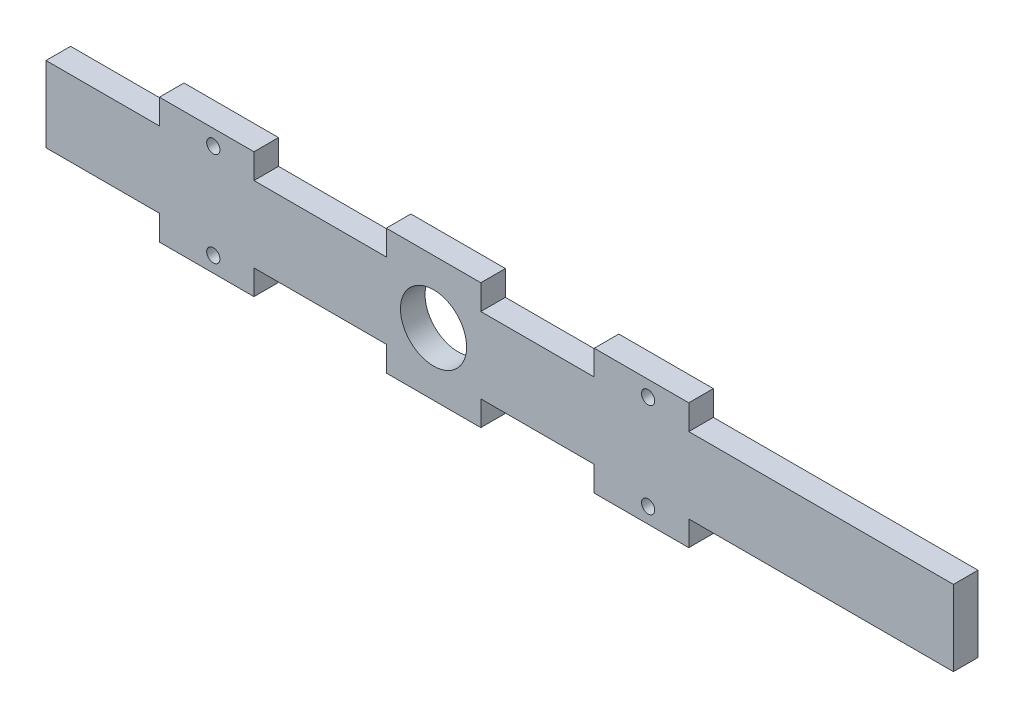
from build123d import *

# Parameters (mm, degrees)
SKETCH1_R              = 3.5
BOSS_EXTRUDE1_DEPTH    = 13
F_25_0MM_DOWEL_HOLE1_D = 35


with BuildPart() as part:
    # Sketch1 → Boss-Extrude1 (new body)
    with BuildSketch(Plane.XY):
        Polygon((-103.143983002, 33.195876289), (-53.143983002, 33.195876289), (-53.143983002, 20), (16.856016998, 20), (16.856016998, 33.195876289), (66.856016998, 33.195876289), (66.856016998, 20), (126.856016998, 20), (126.856016998, 33.195876289), (176.856016998, 33.195876289), (176.856016998, 20), (316.856016998, 20), (316.856016998, -20), (176.856016998, -20), (176.856016998, -33.195876289), (126.856016998, -33.195876289), (126.856016998, -20), (66.856016998, -20), (66.856016998, -33.195876289), (16.856016998, -33.195876289), (16.856016998, -20), (-53.143983002, -20), (-53.143983002, -33.195876289), (-103.143983002, -33.195876289), (-103.143983002, -20), (-163.143983002, -20), (-163.143983002, 20), (-103.143983002, 20), align=None)
        with Locations(Location((-74.643983002, 25, 0), (0, 0, 180))):
            Circle(SKETCH1_R, mode=Mode.SUBTRACT)
        with Locations(Location((155.356016998, 25, 0), (0, 0, 180))):
            Circle(SKETCH1_R, mode=Mode.SUBTRACT)
        with Locations(Location((155.356016998, -25, 0), (0, 0, 180))):
            Circle(SKETCH1_R, mode=Mode.SUBTRACT)
        with Locations(Location((-74.643983002, -25, 0), (0, 0, 180))):
            Circle(SKETCH1_R, mode=Mode.SUBTRACT)
    extrude(amount=BOSS_EXTRUDE1_DEPTH)

    # Ø25.0mm Dowel Hole1 (through all)
    with Locations(Plane(origin=(41.856016998, 0, 13), x_dir=(1, 0, 0), z_dir=(0, 0, 1))):
        with Locations((0, 0)):
            Hole(F_25_0MM_DOWEL_HOLE1_D / 2)


solid = part.part
